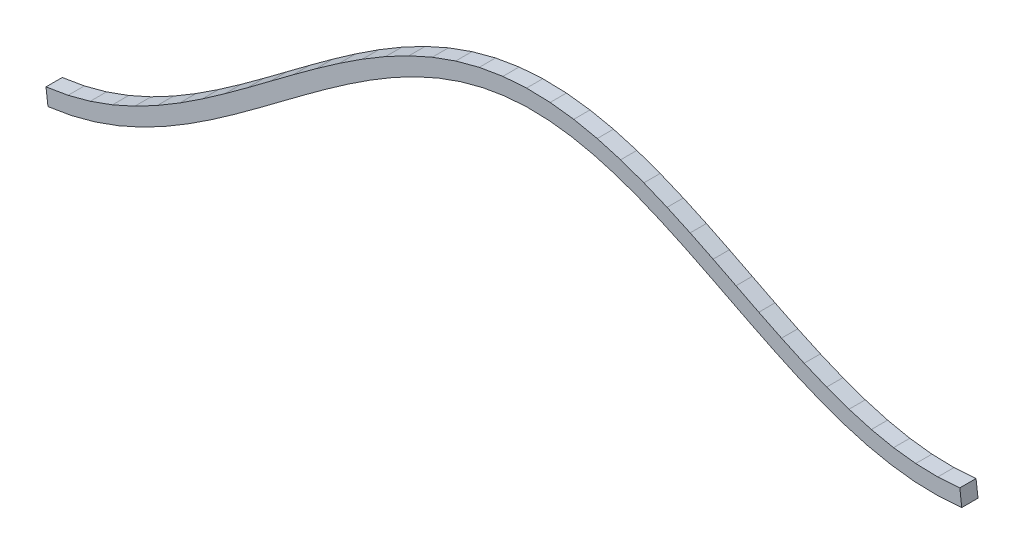
from build123d import *

# Parameters (mm, degrees)
SERVICE_BOW_DEPTH = 4


with BuildPart() as part:
    # 草图1 → Service_Bow (new body)
    with BuildSketch(Plane.XY):
        Polygon((0.238238251, -1.985759939), (6.052696728, -1.00199462), (11.851815581, 0.543134876), (17.629770487, 2.623716718), (23.383882437, 5.20057493), (29.113972134, 8.223185483), (34.821368817, 11.631260703), (40.508013578, 15.356118412), (46.175832601, 19.322053213), (51.826370472, 23.44786233), (57.46060541, 27.648580809), (63.078870472, 31.837413257), (68.680832601, 35.92781796), (74.265513578, 39.8356909), (79.831368817, 43.481597056), (85.376472134, 46.792990637), (90.898882437, 49.706339676), (96.397270487, 52.169010306), (101.871815581, 54.140678109), (107.325196728, 55.593980706), (112.763238251, 56.514240061), (118.194648786, 56.898458582), (123.629616677, 56.754246479), (129.077741493, 56.099396062), (134.546278673, 54.962260391), (140.039426657, 53.382396607), (145.558668032, 51.410746743), (151.103674368, 49.108979529), (156.673265064, 46.548051938), (162.266147999, 43.806258645), (167.881387728, 40.967036021), (173.518647999, 38.116707719), (179.178265064, 35.342287191), (184.861174368, 32.729407041), (190.568668032, 30.36041039), (196.301926657, 28.312591454), (202.061278673, 26.656495644), (207.845241493, 25.454102473), (213.649616677, 24.756703246), (219.467148786, 24.602483256), (225.288238251, 25.014240061), (224.811761749, 28.985759939), (219.380351214, 28.601541418), (213.945383323, 28.745753521), (208.497258507, 29.400603938), (203.028721327, 30.537739609), (197.535573343, 32.117603393), (192.016331968, 34.089253257), (186.471325632, 36.391020471), (180.901734936, 38.951948062), (175.308852001, 41.693741355), (169.693612272, 44.532963979), (164.056352001, 47.383292281), (158.396734936, 50.157712809), (152.713825632, 52.770592959), (147.006331968, 55.13958961), (141.273073343, 57.187408546), (135.513721327, 58.843504356), (129.729758507, 60.045897527), (123.925383323, 60.743296754), (118.107851214, 60.897516744), (112.286761749, 60.485759939), (106.472303272, 59.50199462), (100.673184419, 57.956865124), (94.895229513, 55.876283282), (89.141117563, 53.29942507), (83.411027866, 50.276814517), (77.703631183, 46.868739297), (72.016986422, 43.143881588), (66.349167399, 39.177946787), (60.698629528, 35.05213767), (55.06439459, 30.851419191), (49.446129528, 26.662586743), (43.844167399, 22.57218204), (38.259486422, 18.6643091), (32.693631183, 15.018402944), (27.148527866, 11.707009363), (21.626117563, 8.793660324), (16.127729513, 6.330989694), (10.653184419, 4.359321891), (5.199803272, 2.906019294), (-0.238238251, 1.985759939), align=None)
    extrude(amount=SERVICE_BOW_DEPTH)


solid = part.part
